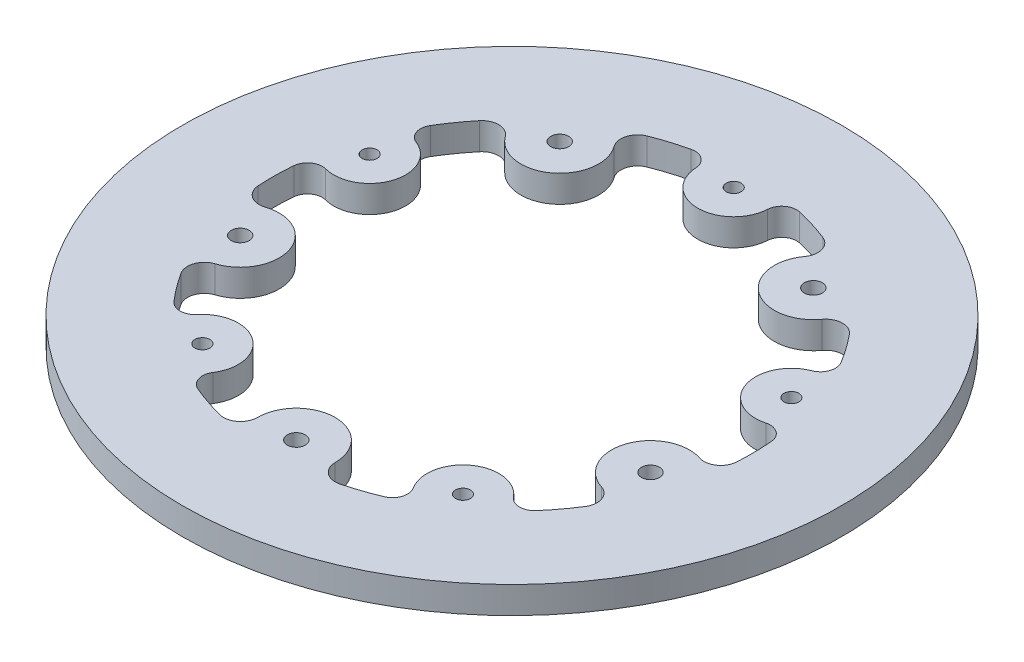
from build123d import *

# Parameters (mm, degrees)
SKETCH2_R           = 110
SKETCH2_R_2         = 2
SKETCH2_R_3         = 3
BOSS_EXTRUDE1_DEPTH = 9
SKETCH4_R           = 2.5
CUT_EXTRUDE1_DEPTH  = 156.823618235


with BuildPart() as part:
    # Sketch2 → Boss-Extrude1 (new body)
    with BuildSketch(Plane(origin=(0, 0, 0), x_dir=(1, 0, 0), z_dir=(0, 1, 0))):
        with Locations(Location((0, 0, 0), (0, 0, 270))):
            Circle(SKETCH2_R)
        with Locations(Location((0, 74, 0), (0, 0, 270))):
            Circle(SKETCH2_R_2, mode=Mode.SUBTRACT)
        with Locations(Location((70.378182206, 22.867257584, 0), (0, 0, 270))):
            Circle(SKETCH2_R_2, mode=Mode.SUBTRACT)
        with Locations(Location((43.49610867, -59.867257584, 0), (0, 0, 270))):
            Circle(SKETCH2_R_2, mode=Mode.SUBTRACT)
        with Locations(Location((-43.49610867, -59.867257584, 0), (0, 0, 270))):
            Circle(SKETCH2_R_2, mode=Mode.SUBTRACT)
        with Locations(Location((-70.378182206, 22.867257584, 0), (0, 0, 270))):
            Circle(SKETCH2_R_2, mode=Mode.SUBTRACT)
        with Locations(Location((0, -72, 0), (0, 0, 270))):
            Circle(SKETCH2_R_3, mode=Mode.SUBTRACT)
        with Locations(Location((-68.476069173, -22.249223595, 0), (0, 0, 270))):
            Circle(SKETCH2_R_3, mode=Mode.SUBTRACT)
        with Locations(Location((-42.320538165, 58.249223595, 0), (0, 0, 270))):
            Circle(SKETCH2_R_3, mode=Mode.SUBTRACT)
        with Locations(Location((42.320538165, 58.249223595, 0), (0, 0, 270))):
            Circle(SKETCH2_R_3, mode=Mode.SUBTRACT)
        with Locations(Location((68.476069173, -22.249223595, 0), (0, 0, 270))):
            Circle(SKETCH2_R_3, mode=Mode.SUBTRACT)
        with BuildLine():
            ThreePointArc((-18.105238982, 77.924324324), (-23.772563309, 76.386289567), (-29.311797662, 74.436674548))
            ThreePointArc((-29.311797662, 74.436674548), (-32.653398245, 70.774561882), (-31.803317238, 65.890431875))
            ThreePointArc((-31.803317238, 65.890431875), (-34.679329885, 47.732002668), (-52.837759092, 50.608015315))
            ThreePointArc((-52.837759092, 50.608015315), (-57.220153284, 52.925769571), (-61.735640767, 50.879373611))
            ThreePointArc((-61.735640767, 50.879373611), (-65.301552386, 46.213712857), (-68.515609894, 41.299046004))
            ThreePointArc((-68.515609894, 41.299046004), (-68.964800278, 37.101160663), (-66.040677784, 34.055915028))
            ThreePointArc((-66.040677784, 34.055915028), (-58.96550401, 19.159053651), (-73.445595254, 11.265922437))
            ThreePointArc((-73.445595254, 11.265922437), (-77.601210519, 10.521023043), (-79.705262959, 6.860834978))
            ThreePointArc((-79.705262959, 6.860834978), (-79.99380451, 0.99561037), (-79.851327994, -4.87497873))
            ThreePointArc((-79.851327994, -4.87497873), (-77.401063247, -9.184684789), (-72.4932901, -9.885488883))
            ThreePointArc((-72.4932901, -9.885488883), (-56.112334461, -18.232002668), (-64.458848246, -34.612958307))
            ThreePointArc((-64.458848246, -34.612958307), (-68.017397816, -38.064637406), (-67.466521973, -42.991492331))
            ThreePointArc((-67.466521973, -42.991492331), (-64.131142201, -47.824644275), (-60.450214656, -52.400110191))
            ThreePointArc((-60.450214656, -52.400110191), (-56.59659591, -54.124533543), (-52.796791661, -52.284560445))
            ThreePointArc((-52.796791661, -52.284560445), (-36.442685642, -50.159053651), (-33.410466041, -66.369550469))
            ThreePointArc((-33.410466041, -66.369550469), (-33.986180358, -70.551962018), (-31.155322609, -73.684095116))
            ThreePointArc((-31.155322609, -73.684095116), (-25.666326768, -75.770968519), (-20.039037085, -77.449577098))
            ThreePointArc((-20.039037085, -77.449577098), (-15.183089607, -76.451009257), (-13, -72))
            ThreePointArc((-13, -72), (0, -59), (13, -72))
            ThreePointArc((13, -72), (15.183089607, -76.451009257), (20.039037085, -77.449577098))
            ThreePointArc((20.039037085, -77.449577098), (25.666326768, -75.770968519), (31.155322609, -73.684095116))
            ThreePointArc((31.155322609, -73.684095116), (33.986180358, -70.551962018), (33.410466041, -66.369550469))
            ThreePointArc((33.410466041, -66.369550469), (36.442685642, -50.159053651), (52.796791661, -52.284560445))
            ThreePointArc((52.796791661, -52.284560445), (56.59659591, -54.124533543), (60.450214656, -52.400110191))
            ThreePointArc((60.450214656, -52.400110191), (64.131142201, -47.824644275), (67.466521973, -42.991492331))
            ThreePointArc((67.466521973, -42.991492331), (68.017397816, -38.064637406), (64.458848246, -34.612958307))
            ThreePointArc((64.458848246, -34.612958307), (56.112334461, -18.232002668), (72.4932901, -9.885488883))
            ThreePointArc((72.4932901, -9.885488883), (77.401063247, -9.184684789), (79.851327994, -4.87497873))
            ThreePointArc((79.851327994, -4.87497873), (79.99380451, 0.99561037), (79.705262959, 6.860834978))
            ThreePointArc((79.705262959, 6.860834978), (77.601210519, 10.521023043), (73.445595254, 11.265922437))
            ThreePointArc((73.445595254, 11.265922437), (58.96550401, 19.159053651), (66.040677784, 34.055915028))
            ThreePointArc((66.040677784, 34.055915028), (68.964800278, 37.101160663), (68.515609894, 41.299046004))
            ThreePointArc((68.515609894, 41.299046004), (65.301552386, 46.213712857), (61.735640767, 50.879373611))
            ThreePointArc((61.735640767, 50.879373611), (57.220153284, 52.925769571), (52.837759092, 50.608015315))
            ThreePointArc((52.837759092, 50.608015315), (34.679329885, 47.732002668), (31.803317238, 65.890431875))
            ThreePointArc((31.803317238, 65.890431875), (32.653398245, 70.774561882), (29.311797662, 74.436674548))
            ThreePointArc((29.311797662, 74.436674548), (23.772563309, 76.386289567), (18.105238982, 77.924324324))
            ThreePointArc((18.105238982, 77.924324324), (13.974005311, 77.054311855), (11.98140815, 73.33227345))
            ThreePointArc((11.98140815, 73.33227345), (0, 62), (-11.98140815, 73.33227345))
            ThreePointArc((-11.98140815, 73.33227345), (-13.974005311, 77.054311855), (-18.105238982, 77.924324324))
        make_face(mode=Mode.SUBTRACT)
    extrude(amount=BOSS_EXTRUDE1_DEPTH)

    # Sketch4 → Cut-Extrude1 (cut, through all)
    with BuildSketch(Plane(origin=(0, 9, 0), x_dir=(1, 0, 0), z_dir=(0, 1, 0))):
        with Locations(Location((0, 74, 0), (0, 0, 270))):
            Circle(SKETCH4_R)
        with Locations(Location((70.378182206, 22.867257584, 0), (0, 0, 270))):
            Circle(SKETCH4_R)
        with Locations(Location((43.49610867, -59.867257584, 0), (0, 0, 270))):
            Circle(SKETCH4_R)
        with Locations(Location((-43.49610867, -59.867257584, 0), (0, 0, 270))):
            Circle(SKETCH4_R)
        with Locations(Location((-70.378182206, 22.867257584, 0), (0, 0, 270))):
            Circle(SKETCH4_R)
    extrude(amount=-CUT_EXTRUDE1_DEPTH, mode=Mode.SUBTRACT)


solid = part.part
